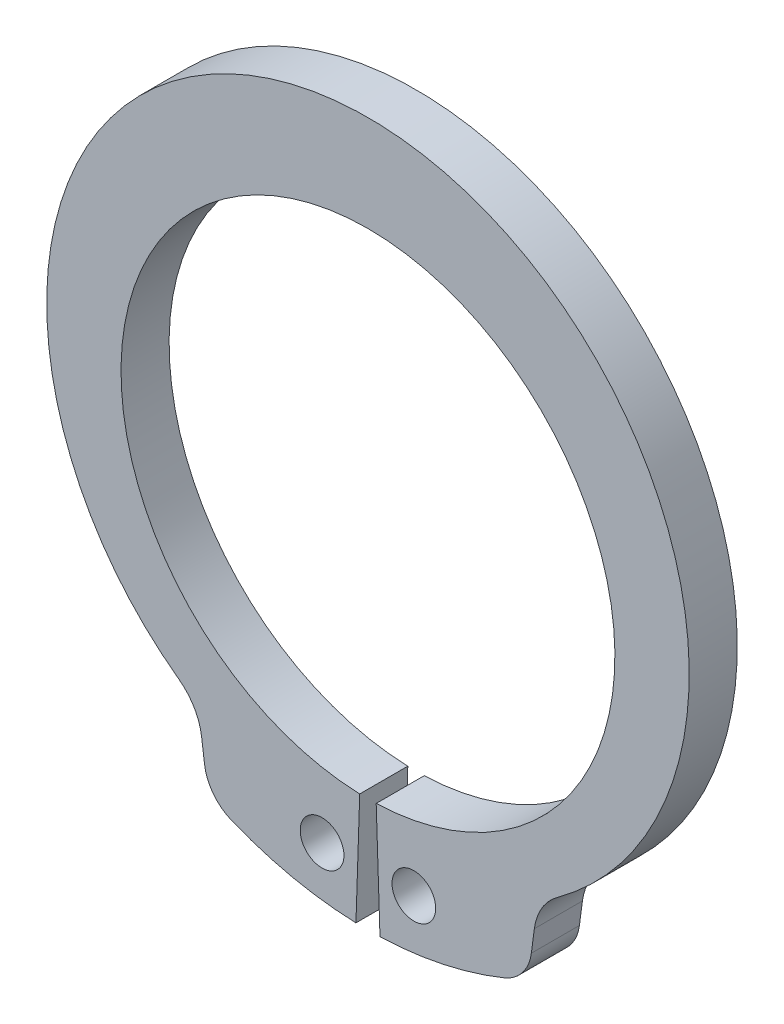
from build123d import *

# Parameters (mm, degrees)
BODYSKE_R  = 0.5
BODY_DEPTH = 1.1


with BuildPart() as part:
    # BodySke → Body (new body)
    with BuildSketch(Plane.XY):
        with BuildLine():
            Line((0.188333333, -5.646860239), (0.275, -8.245415393))
            ThreePointArc((0.275, -8.245415393), (1.727407261, -8.067128619), (3.12546961, -7.635046805))
            ThreePointArc((3.12546961, -7.635046805), (3.538712851, -7.319993445), (3.73806967, -6.840112779))
            Line((3.73806967, -6.840112779), (3.806603957, -6.319543188))
            ThreePointArc((3.806603957, -6.319543188), (3.977611555, -5.825781706), (4.329342258, -5.439349937))
            ThreePointArc((4.329342258, -5.439349937), (0, 7.85), (-4.329342258, -5.439349937))
            ThreePointArc((-4.329342258, -5.439349937), (-3.977611555, -5.825781706), (-3.806603957, -6.319543188))
            Line((-3.806603957, -6.319543188), (-3.73806967, -6.840112779))
            ThreePointArc((-3.73806967, -6.840112779), (-3.538712851, -7.319993445), (-3.12546961, -7.635046805))
            ThreePointArc((-3.12546961, -7.635046805), (-1.727407261, -8.067128619), (-0.275, -8.245415393))
            Line((-0.275, -8.245415393), (-0.188333333, -5.646860239))
            ThreePointArc((-0.188333333, -5.646860239), (0, 5.65), (0.188333333, -5.646860239))
        make_face()
        with Locations((1.05, -7.047206894)):
            Circle(BODYSKE_R, mode=Mode.SUBTRACT)
        with Locations((-1.05, -7.047206894)):
            Circle(BODYSKE_R, mode=Mode.SUBTRACT)
    extrude(amount=-BODY_DEPTH)


solid = part.part
